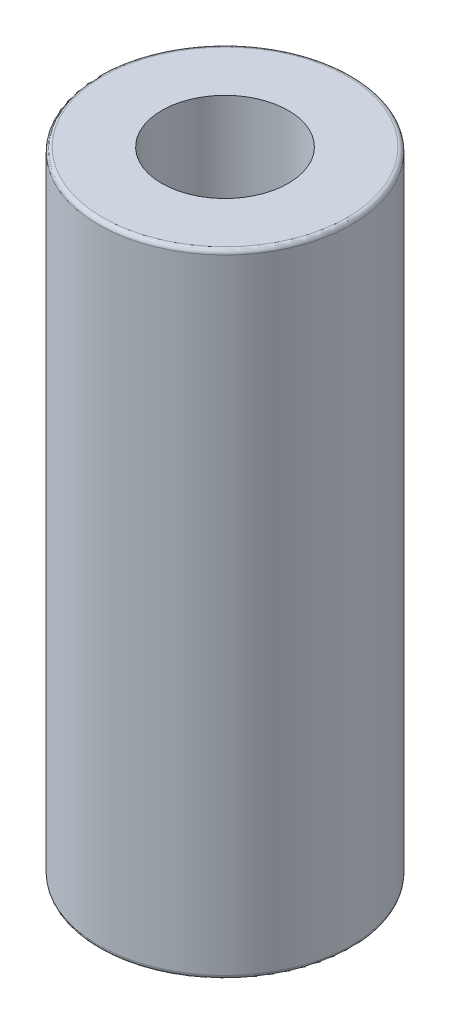
from build123d import *

# Parameters (mm, degrees)
SKETCH_1_R      = 3
SKETCH_1_R_2    = 1.5
EXTRUDE_1_DEPTH = 15
FILLET_1_R      = 0.1


with BuildPart() as part:
    # ｽｹｯﾁ1 → ﾎﾞｽ - 押し出し1 (new body)
    with BuildSketch(Plane(origin=(0, 0, 0), x_dir=(1, 0, 0), z_dir=(0, 1, 0))):
        with Locations(Location((0, 0, 0), (0, 0, 270))):
            Circle(SKETCH_1_R)
        with Locations(Location((0, 0, 0), (0, 0, 270))):
            Circle(SKETCH_1_R_2, mode=Mode.SUBTRACT)
    extrude(amount=EXTRUDE_1_DEPTH)

    # ﾌｨﾚｯﾄ1
    fillet_1_edges = [part.edges().sort_by_distance(p)[0] for p in [
        (0, 0, -3),
        (0, 15, -3),
    ]]
    fillet(fillet_1_edges, radius=FILLET_1_R)


solid = part.part
